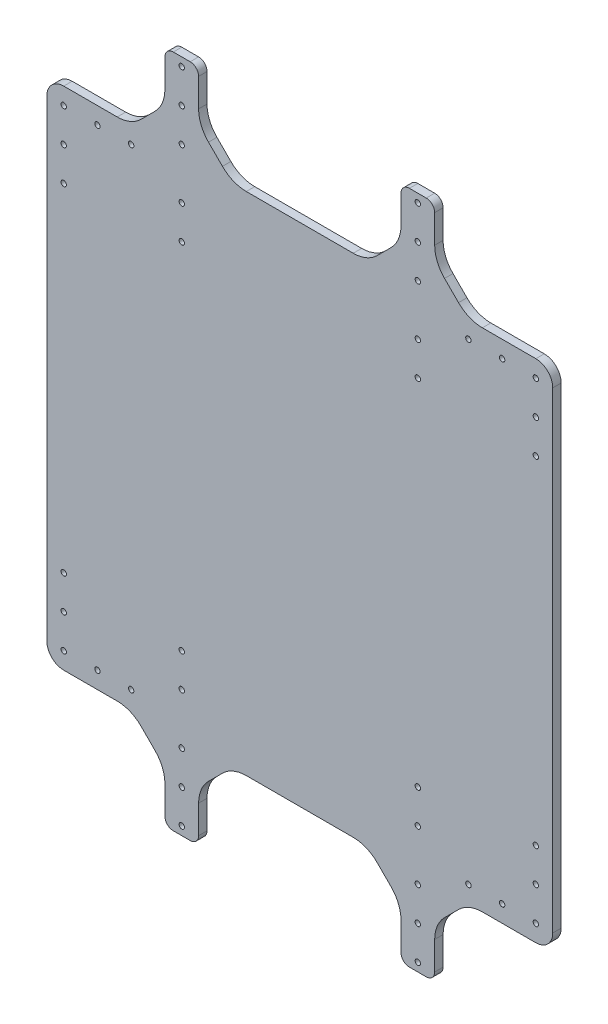
from build123d import *

# Parameters (mm, degrees)
SKETCH_1_W          = 300
SKETCH_1_H          = 300
EXTRUDE_1_DEPTH     = 5
SKETCH_2_R          = 1.6
CUT_EXTRUDE_1_DEPTH = 5
SKETCH_3_W          = 20
SKETCH_3_H          = 50
EXTRUDE_2_DEPTH     = 5
SKETCH_5_R          = 1.6
CUT_EXTRUDE_2_DEPTH = 462.004338374
CHAMFER_1_SIZE      = 20
FILLET_1_R          = 20
FILLET_2_R          = 5
FILLET_3_R          = 10


with BuildPart() as part:
    # 草图1 → 凸台-拉伸1 (new body)
    with BuildSketch(Plane.XY):
        with Locations((150, 150)):
            Rectangle(SKETCH_1_W, SKETCH_1_H)
    extrude(amount=EXTRUDE_1_DEPTH)

    # 草图2 → 切除-拉伸1 (cut)
    with BuildSketch(Plane.XY.offset(5)):
        with Locations((10, 10)):
            Circle(SKETCH_2_R)
        with Locations((290, 10)):
            Circle(SKETCH_2_R)
        with Locations((290, 290)):
            Circle(SKETCH_2_R)
        with Locations((10, 290)):
            Circle(SKETCH_2_R)
        with Locations((10, 270)):
            Circle(SKETCH_2_R)
        with Locations((10, 250)):
            Circle(SKETCH_2_R)
        with Locations((10, 30)):
            Circle(SKETCH_2_R)
        with Locations((10, 50)):
            Circle(SKETCH_2_R)
        with Locations((30, 290)):
            Circle(SKETCH_2_R)
        with Locations((50, 290)):
            Circle(SKETCH_2_R)
        with Locations((270, 290)):
            Circle(SKETCH_2_R)
        with Locations((250, 290)):
            Circle(SKETCH_2_R)
        with Locations((290, 270)):
            Circle(SKETCH_2_R)
        with Locations((290, 250)):
            Circle(SKETCH_2_R)
        with Locations((290, 30)):
            Circle(SKETCH_2_R)
        with Locations((290, 50)):
            Circle(SKETCH_2_R)
        with Locations((270, 10)):
            Circle(SKETCH_2_R)
        with Locations((250, 10)):
            Circle(SKETCH_2_R)
        with Locations((30, 10)):
            Circle(SKETCH_2_R)
        with Locations((50, 10)):
            Circle(SKETCH_2_R)
    extrude(amount=-CUT_EXTRUDE_1_DEPTH, mode=Mode.SUBTRACT)

    # 草图3 → 凸台-拉伸2 (add, through all)
    with BuildSketch(Plane.XY.offset(5)):
        with Locations((80, -25)):
            Rectangle(SKETCH_3_W, SKETCH_3_H)
        with Locations((80, 325)):
            Rectangle(SKETCH_3_W, SKETCH_3_H)
        with Locations((220, 325)):
            Rectangle(SKETCH_3_W, SKETCH_3_H)
        with Locations((220, -25)):
            Rectangle(SKETCH_3_W, SKETCH_3_H)
    extrude(amount=-EXTRUDE_2_DEPTH)

    # 草图5 → 切除-拉伸2 (cut, through all)
    with BuildSketch(Plane.XY.offset(5)):
        with Locations((80, 345)):
            Circle(SKETCH_5_R)
        with Locations((80, 325)):
            Circle(SKETCH_5_R)
        with Locations((80, 305)):
            Circle(SKETCH_5_R)
        with Locations((80, 255)):
            Circle(SKETCH_5_R)
        with Locations((80, 275)):
            Circle(SKETCH_5_R)
        with Locations(Location((80, 25, 0), (0, 0, 180))):
            Circle(SKETCH_5_R)
        with Locations(Location((80, 45, 0), (0, 0, 180))):
            Circle(SKETCH_5_R)
        with Locations(Location((80, -5, 0), (0, 0, 180))):
            Circle(SKETCH_5_R)
        with Locations(Location((80, -25, 0), (0, 0, 180))):
            Circle(SKETCH_5_R)
        with Locations(Location((80, -45, 0), (0, 0, 180))):
            Circle(SKETCH_5_R)
        with Locations((220, -45)):
            Circle(SKETCH_5_R)
        with Locations((220, -25)):
            Circle(SKETCH_5_R)
        with Locations((220, -5)):
            Circle(SKETCH_5_R)
        with Locations((220, 45)):
            Circle(SKETCH_5_R)
        with Locations((220, 25)):
            Circle(SKETCH_5_R)
        with Locations(Location((220, 275, 0), (0, 0, 180))):
            Circle(SKETCH_5_R)
        with Locations(Location((220, 255, 0), (0, 0, 180))):
            Circle(SKETCH_5_R)
        with Locations(Location((220, 305, 0), (0, 0, 180))):
            Circle(SKETCH_5_R)
        with Locations(Location((220, 325, 0), (0, 0, 180))):
            Circle(SKETCH_5_R)
        with Locations(Location((220, 345, 0), (0, 0, 180))):
            Circle(SKETCH_5_R)
    extrude(amount=-CUT_EXTRUDE_2_DEPTH, mode=Mode.SUBTRACT)

    # 倒角1
    chamfer_1_edges = [part.edges().sort_by_distance(p)[0] for p in [
        (210, 0, 2.5),
        (230, 0, 2.5),
        (230, 300, 2.5),
        (210, 300, 2.5),
        (90, 300, 2.5),
        (70, 300, 2.5),
        (70, 0, 2.5),
        (90, 0, 2.5),
    ]]
    chamfer(chamfer_1_edges, length=CHAMFER_1_SIZE)

    # 圆角1
    fillet_1_edges = [part.edges().sort_by_distance(p)[0] for p in [
        (230, -20, 2.5),
        (250, 0, 2.5),
        (110, 0, 2.5),
        (190, 0, 2.5),
        (210, -20, 2.5),
        (90, -20, 2.5),
        (50, 0, 2.5),
        (70, -20, 2.5),
        (250, 300, 2.5),
        (230, 320, 2.5),
        (210, 320, 2.5),
        (110, 300, 2.5),
        (190, 300, 2.5),
        (90, 320, 2.5),
        (70, 320, 2.5),
        (50, 300, 2.5),
    ]]
    fillet(fillet_1_edges, radius=FILLET_1_R)

    # 圆角2
    fillet_2_edges = [part.edges().sort_by_distance(p)[0] for p in [
        (230, -50, 2.5),
        (210, -50, 2.5),
        (230, 350, 2.5),
        (210, 350, 2.5),
        (70, 350, 2.5),
        (90, 350, 2.5),
        (70, -50, 2.5),
        (90, -50, 2.5),
    ]]
    fillet(fillet_2_edges, radius=FILLET_2_R)

    # 圆角3
    fillet_3_edges = [part.edges().sort_by_distance(p)[0] for p in [
        (0, 300, 2.5),
        (300, 300, 2.5),
        (300, 0, 2.5),
        (0, 0, 2.5),
    ]]
    fillet(fillet_3_edges, radius=FILLET_3_R)


solid = part.part
